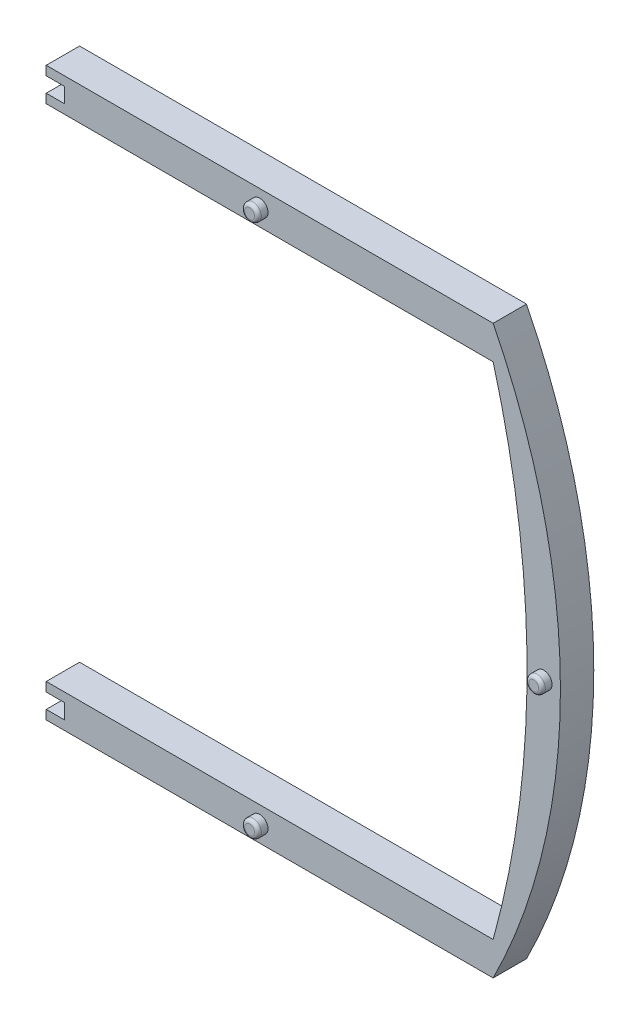
from build123d import *

# Parameters (mm, degrees)
ESQUISSE1_R        = 2.5
BOSS_EXTRU_1_DEPTH = 10
ESQUISSE1_3_R      = 2.5
BOSS_EXTRU_2_DEPTH = 13
CONG_1_R           = 1
ESQUISSE1_4_W      = 3
ESQUISSE1_4_H      = 25
BOSS_EXTRU_3_DEPTH = 2


with BuildPart() as part:
    # Esquisse1 → Boss.-Extru.1 (new body)
    with BuildSketch(Plane.XY):
        with BuildLine():
            Line((-32.758882294, 65.250907441), (-32.758882294, 62.500907441))
            Line((-32.758882294, 62.500907441), (101.241117706, 62.500907441))
            ThreePointArc((101.241117706, 62.500907441), (111.410045947, -12.499092559), (101.241117706, -87.499092559))
            Line((101.241117706, -87.499092559), (-32.758882294, -87.499092559))
            Line((-32.758882294, -87.499092559), (-32.758882294, -90.249092559))
            Line((-32.758882294, -90.249092559), (-27.258882294, -90.249092559))
            Line((-27.258882294, -90.249092559), (-27.258882294, -94.749092559))
            Line((-27.258882294, -94.749092559), (-32.758882294, -94.749092559))
            Line((-32.758882294, -94.749092559), (-32.758882294, -97.499092559))
            Line((-32.758882294, -97.499092559), (101.241117706, -97.499092559))
            ThreePointArc((101.241117706, -97.499092559), (121.410045947, -12.499092559), (101.241117706, 72.500907441))
            Line((101.241117706, 72.500907441), (-32.758882294, 72.500907441))
            Line((-32.758882294, 72.500907441), (-32.758882294, 69.750907441))
            Line((-32.758882294, 69.750907441), (-27.258882294, 69.750907441))
            Line((-27.258882294, 69.750907441), (-27.258882294, 65.250907441))
            Line((-27.258882294, 65.250907441), (-32.758882294, 65.250907441))
        make_face()
        with Locations((31.241117706, 67.500907441)):
            Circle(ESQUISSE1_R, mode=Mode.SUBTRACT)
        with Locations((116.410045947, -12.499092559)):
            Circle(ESQUISSE1_R, mode=Mode.SUBTRACT)
        with Locations((31.241117706, -92.499092559)):
            Circle(ESQUISSE1_R, mode=Mode.SUBTRACT)
    extrude(amount=BOSS_EXTRU_1_DEPTH)

    # Esquisse1<3> → Boss.-Extru.2 (add)
    with BuildSketch(Plane.XY):
        with Locations((116.410045947, -12.499092559)):
            Circle(ESQUISSE1_3_R)
        with Locations((31.241117706, 67.500907441)):
            Circle(ESQUISSE1_3_R)
        with Locations((31.241117706, -92.499092559)):
            Circle(ESQUISSE1_3_R)
    extrude(amount=BOSS_EXTRU_2_DEPTH)

    # Congé1
    cong_1_edges = [part.edges().sort_by_distance(p)[0] for p in [
        (28.741117706, 67.500907441, 13),
        (28.741117706, -92.499092559, 13),
        (113.910045947, -12.499092559, 13),
    ]]
    fillet(cong_1_edges, radius=CONG_1_R)

    # Esquisse1<4> → Boss.-Extru.3 (add)
    with BuildSketch(Plane.XY):
        with Locations((110.410045947, -12.499092559)):
            Rectangle(ESQUISSE1_4_W, ESQUISSE1_4_H)
    extrude(amount=BOSS_EXTRU_3_DEPTH)


solid = part.part
